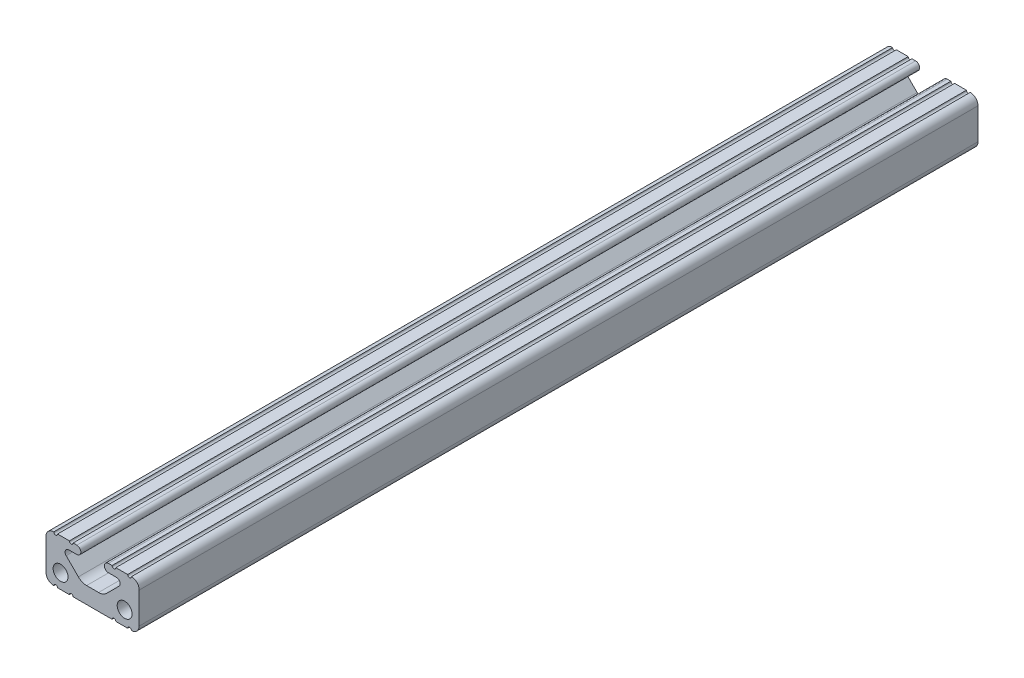
from build123d import *

# Parameters (mm, degrees)
SKETCH1_R           = 2.032
BOSS_EXTRUDE1_DEPTH = 114.3


with BuildPart() as part:
    # Sketch1 → Boss-Extrude1 (new, symmetric)
    with BuildSketch(Plane.XY):
        with BuildLine():
            Line((-12.7, 10.591838253), (-12.7, 2.108161747))
            ThreePointArc((-12.7, 2.108161747), (-12.078025605, 0.612955845), (-10.5791, 0))
            ThreePointArc((-10.5791, 0), (-10.06475, 0.508039196), (-9.5504, 0))
            Line((-9.5504, 0), (-6.3246, 0))
            ThreePointArc((-6.3246, 0), (-5.8166, 0.508), (-5.3086, 0))
            Line((-5.3086, 0), (5.3086, 0))
            ThreePointArc((5.3086, 0), (5.8166, 0.508), (6.3246, 0))
            Line((6.3246, 0), (9.5504, 0))
            ThreePointArc((9.5504, 0), (10.06475, 0.508039196), (10.5791, 0))
            ThreePointArc((10.5791, 0), (12.078025605, 0.612955845), (12.7, 2.108161747))
            Line((12.7, 2.108161747), (12.7, 10.591838253))
            ThreePointArc((12.7, 10.591838253), (12.078025605, 12.087044155), (10.5791, 12.7))
            ThreePointArc((10.5791, 12.7), (10.06475, 12.191960804), (9.5504, 12.7))
            Line((9.5504, 12.7), (6.3246, 12.7))
            ThreePointArc((6.3246, 12.7), (5.816599999, 12.191999983), (5.3086, 12.700000002))
            Line((5.3086, 12.700000002), (4.302307889, 12.700000002))
            ThreePointArc((4.302307889, 12.700000002), (3.197407889, 11.595100002), (4.302307889, 10.490200002))
            Line((4.302307889, 10.490200002), (6.487959021, 10.490200002))
            ThreePointArc((6.487959021, 10.490200002), (7.426620626, 9.863006369), (7.20637951, 8.755779512))
            Line((7.20637951, 8.755779512), (3.87633597, 5.425735971))
            ThreePointArc((3.87633597, 5.425735971), (2.846291837, 4.737482486), (1.631271939, 4.495800002))
            Line((1.631271939, 4.495800002), (-1.631271939, 4.495800002))
            ThreePointArc((-1.631271939, 4.495800002), (-2.846291837, 4.737482486), (-3.87633597, 5.425735971))
            Line((-3.87633597, 5.425735971), (-7.20637951, 8.755779512))
            ThreePointArc((-7.20637951, 8.755779512), (-7.426620626, 9.863006369), (-6.487959021, 10.490200002))
            Line((-6.487959021, 10.490200002), (-4.302307889, 10.490200002))
            ThreePointArc((-4.302307889, 10.490200002), (-3.197407889, 11.595100002), (-4.302307889, 12.700000002))
            Line((-4.302307889, 12.700000002), (-5.3086, 12.700000002))
            ThreePointArc((-5.3086, 12.700000002), (-5.816599999, 12.191999985), (-6.3246, 12.7))
            Line((-6.3246, 12.7), (-9.5504, 12.7))
            ThreePointArc((-9.5504, 12.7), (-10.06475, 12.191960804), (-10.5791, 12.7))
            ThreePointArc((-10.5791, 12.7), (-12.078025605, 12.087044155), (-12.7, 10.591838253))
        make_face()
        with Locations((-8.73125, 3.9624)):
            Circle(SKETCH1_R, mode=Mode.SUBTRACT)
        with Locations((8.73125, 3.9624)):
            Circle(SKETCH1_R, mode=Mode.SUBTRACT)
    extrude(amount=BOSS_EXTRUDE1_DEPTH, both=True)


solid = part.part
